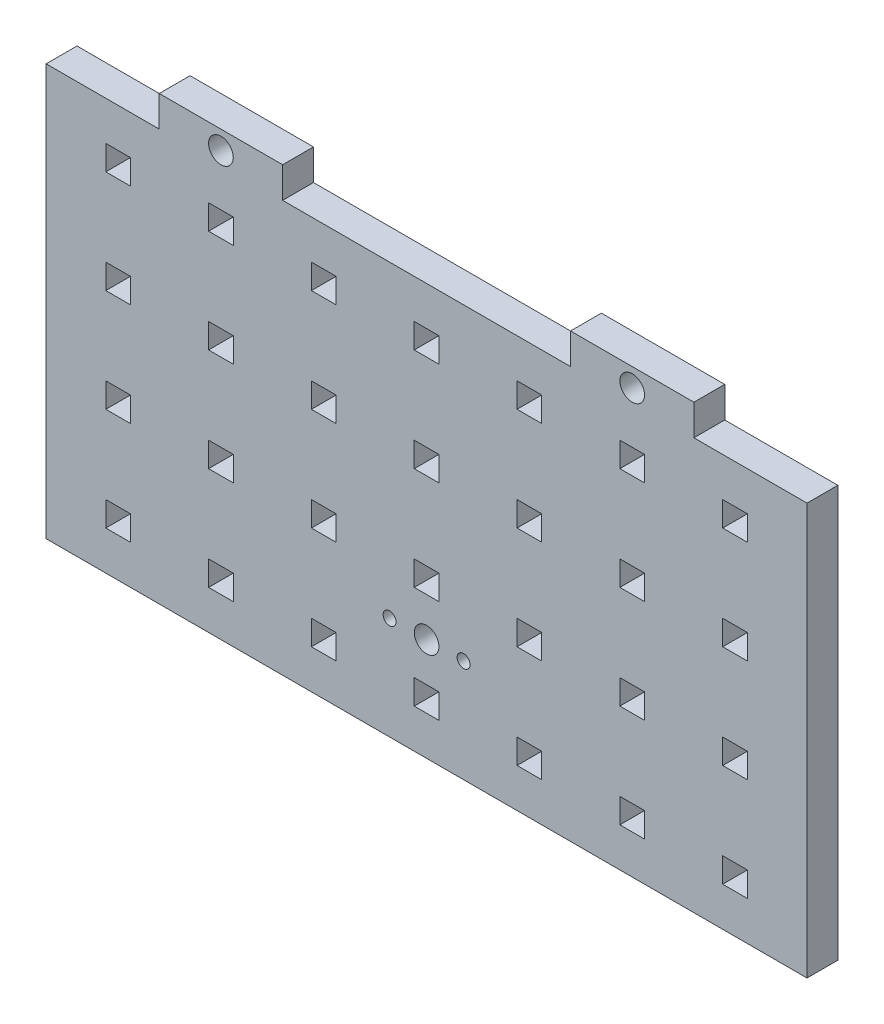
from build123d import *

# Parameters (mm, degrees)
SKETCH1_W            = 93.98
SKETCH1_H            = 50.8
BOSS_EXTRUDE4_DEPTH  = 3.81
SKETCH26_W           = 3.048
SKETCH26_H           = 3.048
CUT_EXTRUDE30_DEPTH  = 54.551248351
LPATTERN9_COUNT      = 4
LPATTERN9_PITCH      = 12.7
LPATTERN9_COUNT_DIR2 = 7
LPATTERN9_PITCH_DIR2 = 12.7
SKETCH25_R           = 1.524
SKETCH25_R_2         = 0.8
CUT_EXTRUDE29_DEPTH  = 54.551248351
SKETCH27_W           = 15.24
SKETCH27_H           = 3.81
BOSS_EXTRUDE5_DEPTH  = 3.81
SKETCH28_R           = 1.524
CUT_EXTRUDE31_DEPTH  = 56.459898125


with BuildPart() as part:
    # Sketch1 → Boss-Extrude4 (new body)
    with BuildSketch(Plane.XY):
        Rectangle(SKETCH1_W, SKETCH1_H)
    extrude(amount=BOSS_EXTRUDE4_DEPTH)

    # Sketch26 → Cut-Extrude30 (cut, through all)
    with BuildSketch(Plane.XY.offset(3.81)):
        with Locations((38.1, 19.05)):
            Rectangle(SKETCH26_W, SKETCH26_H)
    cut_extrude30 = extrude(amount=-CUT_EXTRUDE30_DEPTH, mode=Mode.SUBTRACT)

    # LPattern9: Cut-Extrude30 4 × 7
    with Locations(*[(-j * LPATTERN9_PITCH_DIR2, -i * LPATTERN9_PITCH, 0) for i in range(LPATTERN9_COUNT) for j in range(LPATTERN9_COUNT_DIR2) if (i, j) != (0, 0)]):
        add(cut_extrude30, mode=Mode.SUBTRACT)

    # Sketch25 → Cut-Extrude29 (cut, through all)
    with BuildSketch(Plane.XY.offset(3.81)):
        with Locations((0, -12.7)):
            Circle(SKETCH25_R)
        with Locations((-4.572, -12.7)):
            Circle(SKETCH25_R_2)
        with Locations((4.572, -12.7)):
            Circle(SKETCH25_R_2)
    extrude(amount=-CUT_EXTRUDE29_DEPTH, mode=Mode.SUBTRACT)

    # Sketch27 → Boss-Extrude5 (add)
    with BuildSketch(Plane.XY.offset(3.81)):
        with Locations((25.4, 27.305)):
            Rectangle(SKETCH27_W, SKETCH27_H)
    boss_extrude5 = extrude(amount=-BOSS_EXTRUDE5_DEPTH)

    # Sketch28 → Cut-Extrude31 (cut, through all)
    with BuildSketch(Plane.XY.offset(3.81)):
        with Locations((25.4, 26.924)):
            Circle(SKETCH28_R)
    cut_extrude31 = extrude(amount=-CUT_EXTRUDE31_DEPTH, mode=Mode.SUBTRACT)

    # Mirror1: Boss-Extrude5, Cut-Extrude31 across plane
    add(boss_extrude5.mirror(Plane(origin=(0, 0, 0), x_dir=(0, 0, 1), z_dir=(1, 0, 0))))
    add(cut_extrude31.mirror(Plane(origin=(0, 0, 0), x_dir=(0, 0, 1), z_dir=(1, 0, 0))), mode=Mode.SUBTRACT)


solid = part.part
